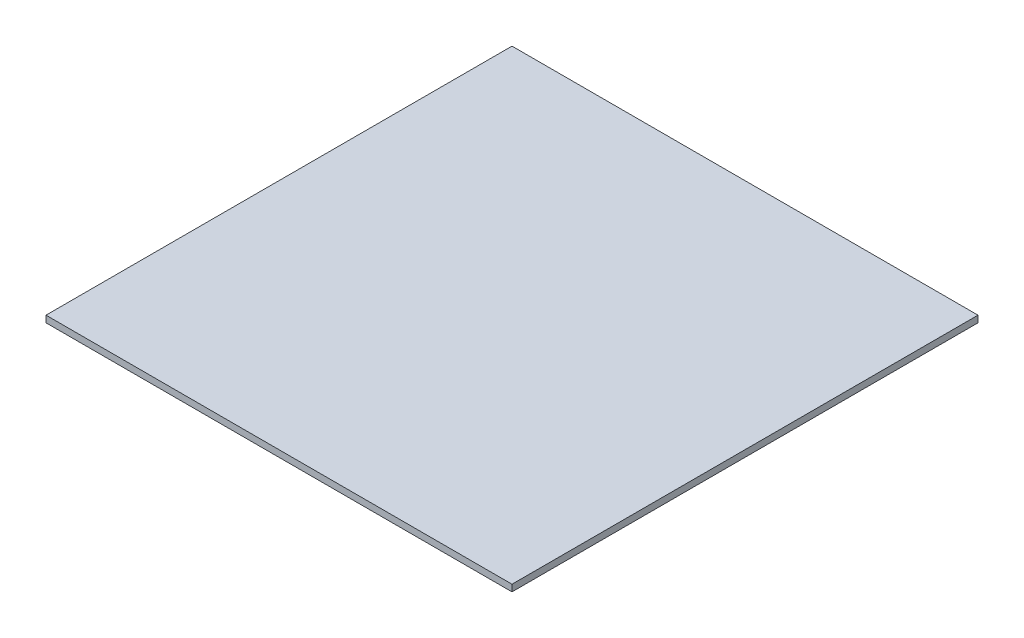
from build123d import *

# Parameters (mm, degrees)
SKETCH1_W           = 35.56
SKETCH1_H           = 35.56
BOSS_EXTRUDE1_DEPTH = 0.254


with BuildPart() as part:
    # Sketch1 → Boss-Extrude1 (new, symmetric)
    with BuildSketch(Plane(origin=(0, 0, 0), x_dir=(1, 0, 0), z_dir=(0, 1, 0))):
        Rectangle(SKETCH1_W, SKETCH1_H)
    extrude(amount=BOSS_EXTRUDE1_DEPTH, both=True)


solid = part.part
